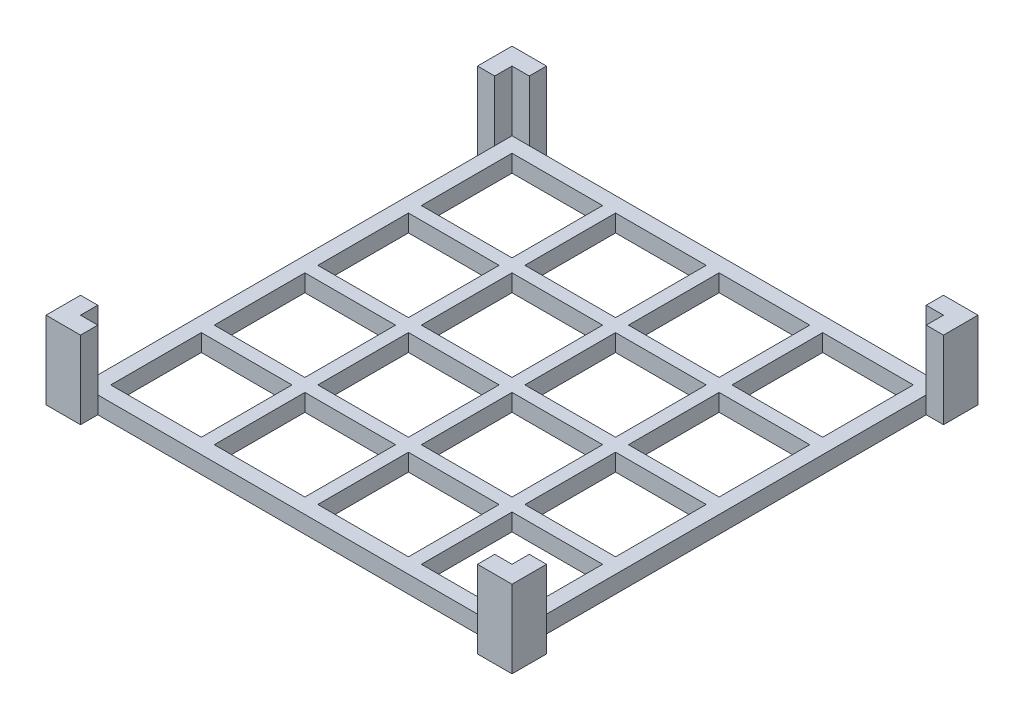
from build123d import *

# Parameters (mm, degrees)
SKETCH1_W           = 10.5
SKETCH1_H           = 10.5
BOSS_EXTRUDE1_DEPTH = 2
BOSS_EXTRUDE2_DEPTH = 9


with BuildPart() as part:
    # Sketch1 → Boss-Extrude1 (new body)
    with BuildSketch(Plane(origin=(0, 0, 0), x_dir=(1, 0, 0), z_dir=(0, 1, 0))):
        Polygon((4, 31), (-42, 31), (-44, 31), (-44, 29), (-44, -17), (-44, -19), (-42, -19), (4, -19), (6, -19), (6, -17), (6, 29), (6, 31), align=None)
        with Locations((-37, -12)):
            Rectangle(SKETCH1_W, SKETCH1_H, mode=Mode.SUBTRACT)
        with Locations((-25, -12)):
            Rectangle(SKETCH1_W, SKETCH1_H, mode=Mode.SUBTRACT)
        with Locations((-37, 0)):
            Rectangle(SKETCH1_W, SKETCH1_H, mode=Mode.SUBTRACT)
        with Locations((-25, 0)):
            Rectangle(SKETCH1_W, SKETCH1_H, mode=Mode.SUBTRACT)
        with Locations((-13, -12)):
            Rectangle(SKETCH1_W, SKETCH1_H, mode=Mode.SUBTRACT)
        with Locations((-1, -12)):
            Rectangle(SKETCH1_W, SKETCH1_H, mode=Mode.SUBTRACT)
        with Locations((-13, 0)):
            Rectangle(SKETCH1_W, SKETCH1_H, mode=Mode.SUBTRACT)
        with Locations((-1, 0)):
            Rectangle(SKETCH1_W, SKETCH1_H, mode=Mode.SUBTRACT)
        with Locations((-37, 12)):
            Rectangle(SKETCH1_W, SKETCH1_H, mode=Mode.SUBTRACT)
        with Locations((-25, 12)):
            Rectangle(SKETCH1_W, SKETCH1_H, mode=Mode.SUBTRACT)
        with Locations((-37, 24)):
            Rectangle(SKETCH1_W, SKETCH1_H, mode=Mode.SUBTRACT)
        with Locations((-25, 24)):
            Rectangle(SKETCH1_W, SKETCH1_H, mode=Mode.SUBTRACT)
        with Locations((-13, 12)):
            Rectangle(SKETCH1_W, SKETCH1_H, mode=Mode.SUBTRACT)
        with Locations((-1, 12)):
            Rectangle(SKETCH1_W, SKETCH1_H, mode=Mode.SUBTRACT)
        with Locations((-13, 24)):
            Rectangle(SKETCH1_W, SKETCH1_H, mode=Mode.SUBTRACT)
        with Locations((-1, 24)):
            Rectangle(SKETCH1_W, SKETCH1_H, mode=Mode.SUBTRACT)
    extrude(amount=BOSS_EXTRUDE1_DEPTH)

    # Sketch1<32> → Boss-Extrude2 (add)
    with BuildSketch(Plane(origin=(0, 0, 0), x_dir=(1, 0, 0), z_dir=(0, 1, 0))):
        Polygon((-44, 31), (-42, 31), (-42, 33), (-46, 33), (-46, 29), (-44, 29), align=None)
        Polygon((4, 33), (4, 31), (6, 31), (6, 29), (8, 29), (8, 33), align=None)
        Polygon((-44, -19), (-44, -17), (-46, -17), (-46, -21), (-42, -21), (-42, -19), align=None)
        Polygon((8, -17), (6, -17), (6, -19), (4, -19), (4, -21), (8, -21), align=None)
    extrude(amount=BOSS_EXTRUDE2_DEPTH)


solid = part.part
